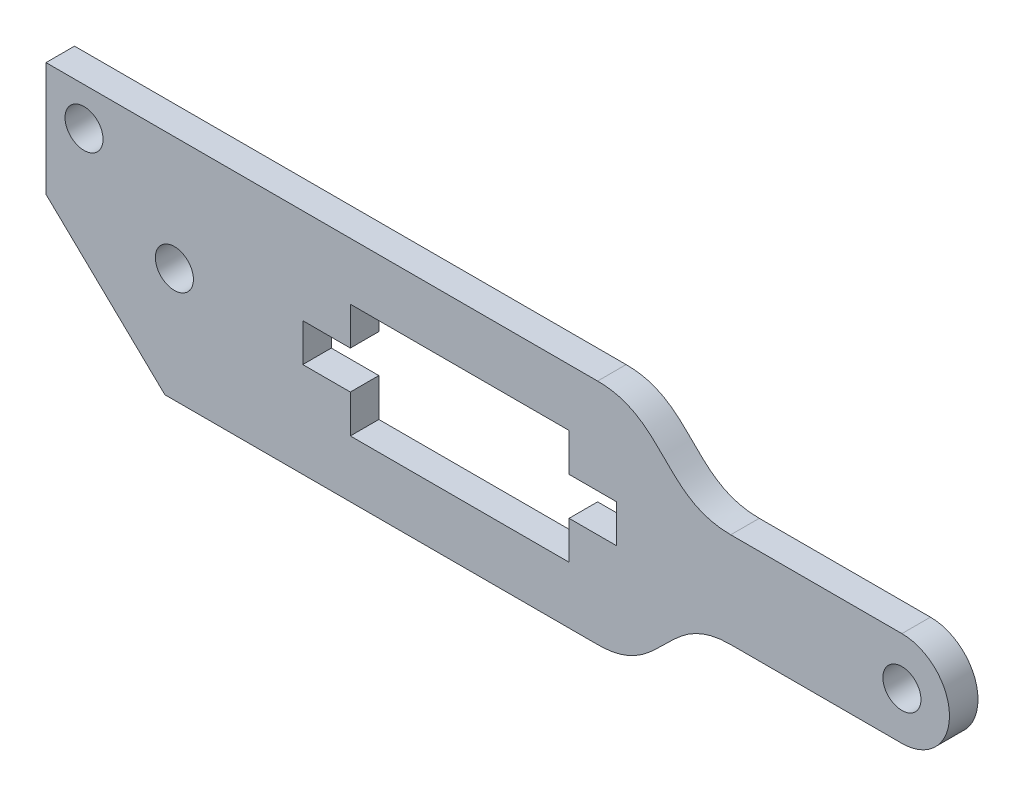
from build123d import *

# Parameters (mm, degrees)
ESQUISSE1_R        = 2
BOSS_EXTRU_1_DEPTH = 3


with BuildPart() as part:
    # Esquisse1 → Boss.-Extru.1 (new body)
    with BuildSketch(Plane.XY):
        with BuildLine():
            Line((-47.5, 12), (-47.5, 0))
            Line((-47.5, 0), (-35, -12))
            Line((-35, -12), (10.5, -12))
            add(Edge.make_bspline(
                [(10.5, -12), (17.5, -12), (17.5, -5), (24.5, -5)],
                knots=[0.5, 0.5, 0.5, 0.5, 1.5, 1.5, 1.5, 1.5], degree=3))
            Line((24.5, -5), (42.5, -5))
            ThreePointArc((42.5, -5), (47.5, 0), (42.5, 5))
            Line((42.5, 5), (24.5, 5))
            add(Edge.make_bspline(
                [(24.5, 5), (17.5, 5), (17.5, 12), (10.5, 12)],
                knots=[0, 0, 0, 0, 1, 1, 1, 1], degree=3))
            Line((10.5, 12), (-47.5, 12))
        make_face()
        with Locations((-34, 0)):
            Circle(ESQUISSE1_R, mode=Mode.SUBTRACT)
        Polygon((-15.5, 2), (-15.5, 6), (7.5, 6), (7.5, 2), (12.5, 2), (12.5, -2), (7.5, -2), (7.5, -6), (-15.5, -6), (-15.5, -2), (-20.5, -2), (-20.5, 2), align=None, mode=Mode.SUBTRACT)
        with Locations((-43.5, 8)):
            Circle(ESQUISSE1_R, mode=Mode.SUBTRACT)
        with Locations((42.5, 0)):
            Circle(ESQUISSE1_R, mode=Mode.SUBTRACT)
    extrude(amount=BOSS_EXTRU_1_DEPTH)


solid = part.part
